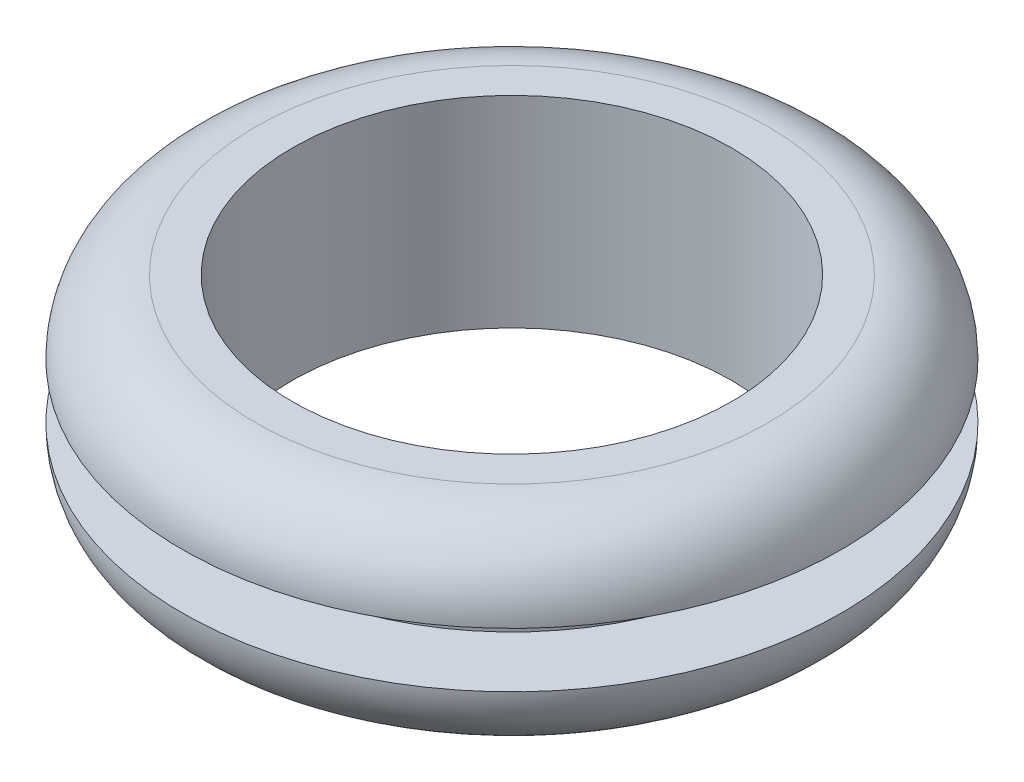
from build123d import *


with BuildPart() as part:
    # Sketch2 → Revolve1 (revolve)
    with BuildSketch(Plane(origin=(0, 0, 0), x_dir=(0, 0, -1), z_dir=(1, 0, 0)), mode=Mode.PRIVATE) as revolve1_sk:
        with BuildLine():
            Line((-9.525, -4.365625), (-9.525, 4.365625))
            Line((-9.525, 4.365625), (-11.1125, 4.365625))
            ThreePointArc((-11.1125, 4.365625), (-13.35756403, 3.43568903), (-14.2875, 1.190625))
            Line((-14.2875, 1.190625), (-11.1125, 1.190625))
            Line((-11.1125, 1.190625), (-11.1125, -1.190625))
            Line((-11.1125, -1.190625), (-14.2875, -1.190625))
            ThreePointArc((-14.2875, -1.190625), (-13.35756403, -3.43568903), (-11.1125, -4.365625))
            Line((-11.1125, -4.365625), (-9.525, -4.365625))
        make_face()
    revolve(revolve1_sk.sketch.rotate(Axis((0, -4.365625, 0), (0, 1, 0)), 180), axis=Axis((0, -4.365625, 0), (0, 1, 0)))


solid = part.part
